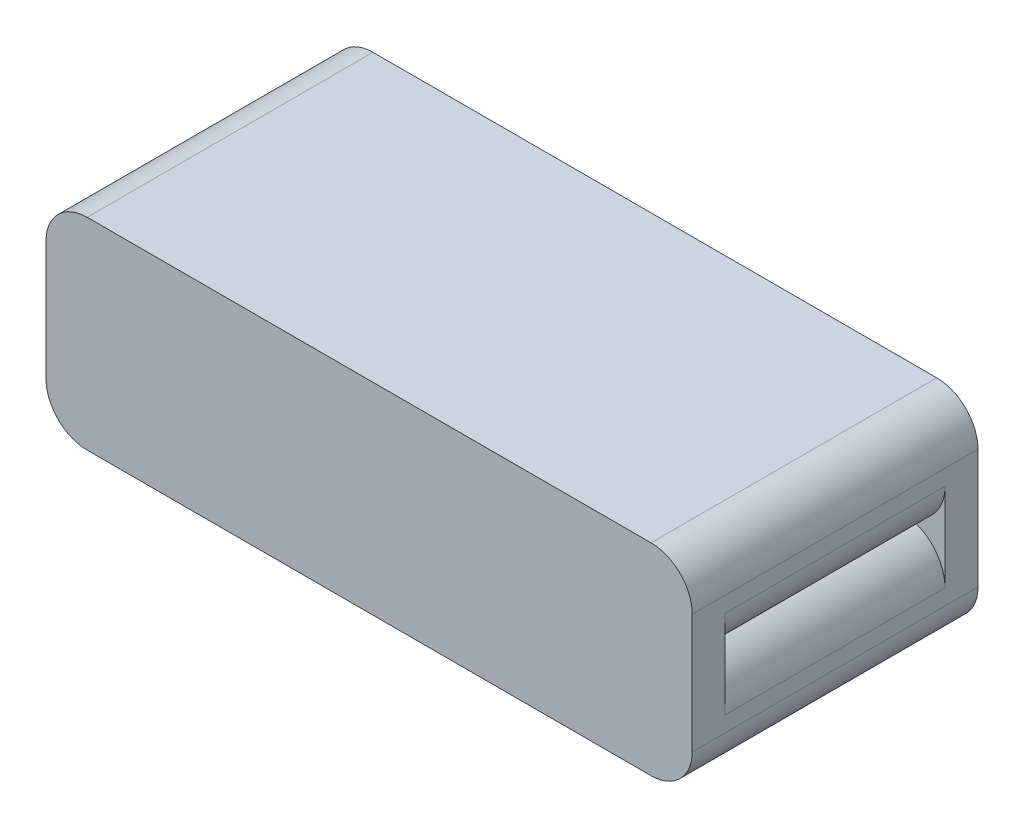
from build123d import *

# Parameters (mm, degrees)
SKETCH1_W           = 149.352
SKETCH1_H           = 66.04
BOSS_EXTRUDE1_DEPTH = 23.3045
FILLET1_R           = 9.525
CUT_EXTRUDE1_DEPTH  = 25.4


with BuildPart() as part:
    # Sketch1 → Boss-Extrude1 (new, symmetric)
    with BuildSketch(Plane(origin=(0, 0, 0), x_dir=(1, 0, 0), z_dir=(0, 1, 0))):
        Rectangle(SKETCH1_W, SKETCH1_H)
    extrude(amount=BOSS_EXTRUDE1_DEPTH, both=True)

    # Fillet1
    fillet1_edges = [part.edges().sort_by_distance(p)[0] for p in [
        (74.676, 23.3045, 0),
        (-74.676, 23.3045, 0),
        (74.676, -23.3045, 0),
        (-74.676, -23.3045, 0),
    ]]
    fillet(fillet1_edges, radius=FILLET1_R)

    # Sketch2 → Cut-Extrude1 (cut, symmetric)
    with BuildSketch(Plane.XY):
        with BuildLine():
            Line((-74.676, 10.16), (-74.676, -10.16))
            ThreePointArc((-74.676, -10.16), (-71.700204897, -2.975795103), (-64.516, 0))
            ThreePointArc((-64.516, 0), (-71.700204897, 2.975795103), (-74.676, 10.16))
        make_face()
    cut_extrude1 = extrude(amount=CUT_EXTRUDE1_DEPTH, both=True, mode=Mode.SUBTRACT)

    # Mirror1: Cut-Extrude1 across plane
    add(cut_extrude1.mirror(Plane(origin=(0, 0, 0), x_dir=(0, 0, 1), z_dir=(1, 0, 0))), mode=Mode.SUBTRACT)


solid = part.part
